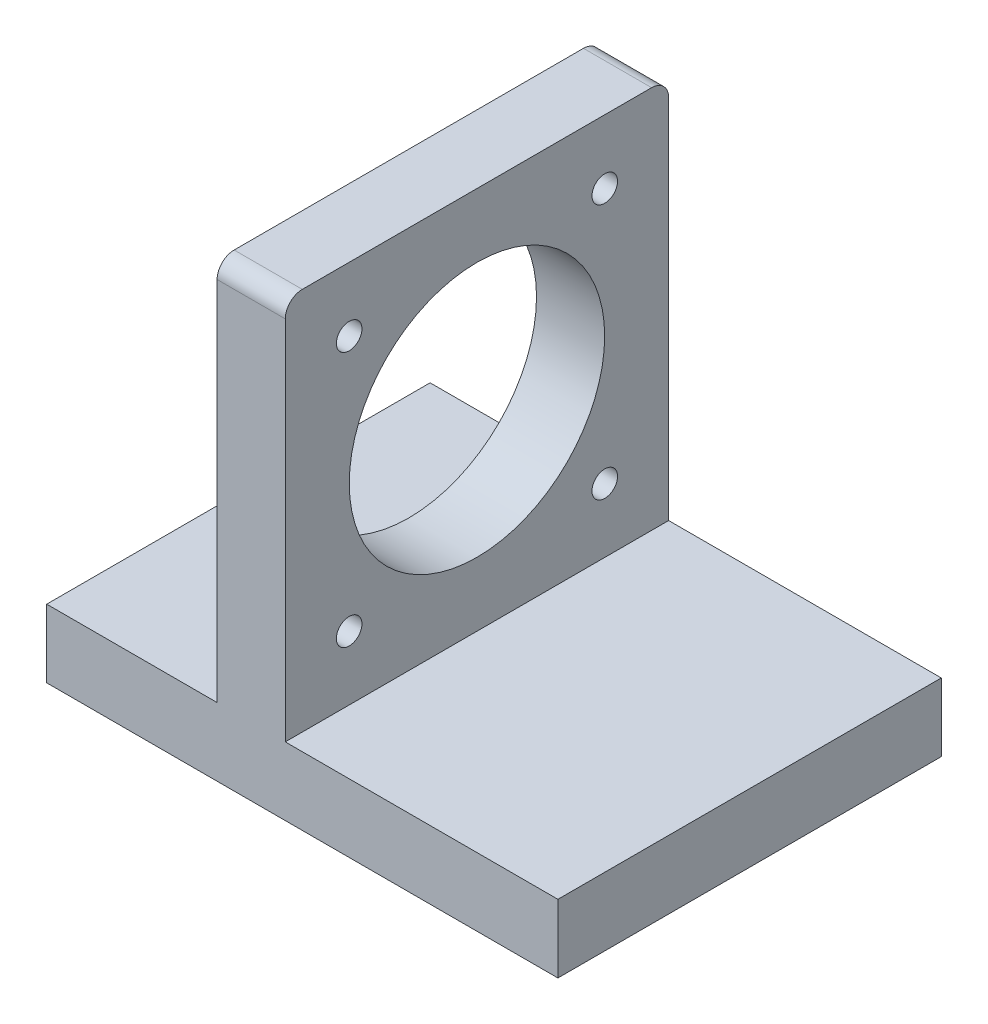
from build123d import *

# Parameters (mm, degrees)
SKETCH1_W           = 60
SKETCH1_H           = 45
BOSS_EXTRUDE1_DEPTH = 8
SKETCH2_R           = 5
CUT_EXTRUDE1_DEPTH  = 5
SKETCH3_W           = 20
SKETCH3_H           = 40
CUT_EXTRUDE2_DEPTH  = 5
SKETCH4_W           = 8
SKETCH4_H           = 45
BOSS_EXTRUDE3_DEPTH = 45
SKETCH6_R           = 1.5
CUT_EXTRUDE3_DEPTH  = 45
FILLET2_R           = 2
SKETCH7_R           = 14.99024042
CUT_EXTRUDE4_DEPTH  = 71.10884395


with BuildPart() as part:
    # Sketch1 → Boss-Extrude1 (new body)
    with BuildSketch(Plane(origin=(0, 0, 0), x_dir=(1, 0, 0), z_dir=(0, 1, 0))):
        Rectangle(SKETCH1_W, SKETCH1_H)
    extrude(amount=BOSS_EXTRUDE1_DEPTH)

    # Sketch2 → Cut-Extrude1 (cut)
    with BuildSketch(Plane.XZ):
        with Locations(Location((-20, 14.5, 0), (0, 0, 270))):
            Circle(SKETCH2_R)
        with Locations(Location((-20, -14.5, 0), (0, 0, 270))):
            Circle(SKETCH2_R)
    extrude(amount=-CUT_EXTRUDE1_DEPTH, mode=Mode.SUBTRACT)

    # Sketch3 → Cut-Extrude2 (cut)
    with BuildSketch(Plane.XZ):
        Rectangle(SKETCH3_W, SKETCH3_H)
    extrude(amount=-CUT_EXTRUDE2_DEPTH, mode=Mode.SUBTRACT)

    # Sketch4 → Boss-Extrude3 (add)
    with BuildSketch(Plane(origin=(0, 8, 0), x_dir=(1, 0, 0), z_dir=(0, 1, 0))):
        with Locations((-6, 0)):
            Rectangle(SKETCH4_W, SKETCH4_H)
    extrude(amount=BOSS_EXTRUDE3_DEPTH)

    # Sketch6 → Cut-Extrude3 (cut)
    with BuildSketch(Plane.ZY.offset(10)):
        with Locations((-15, 45.5)):
            Circle(SKETCH6_R)
        with Locations((15, 45.5)):
            Circle(SKETCH6_R)
        with Locations((15, 15.5)):
            Circle(SKETCH6_R)
        with Locations((-15, 15.5)):
            Circle(SKETCH6_R)
    extrude(amount=-CUT_EXTRUDE3_DEPTH, mode=Mode.SUBTRACT)

    # Fillet2
    fillet2_edges = [part.edges().sort_by_distance(p)[0] for p in [
        (-6, 53, -22.5),
        (-6, 53, 22.5),
    ]]
    fillet(fillet2_edges, radius=FILLET2_R)

    # Sketch7 → Cut-Extrude4 (cut, through all)
    with BuildSketch(Plane.ZY.offset(10)):
        with Locations((0, 30.5)):
            Circle(SKETCH7_R)
    extrude(amount=-CUT_EXTRUDE4_DEPTH, mode=Mode.SUBTRACT)


solid = part.part
